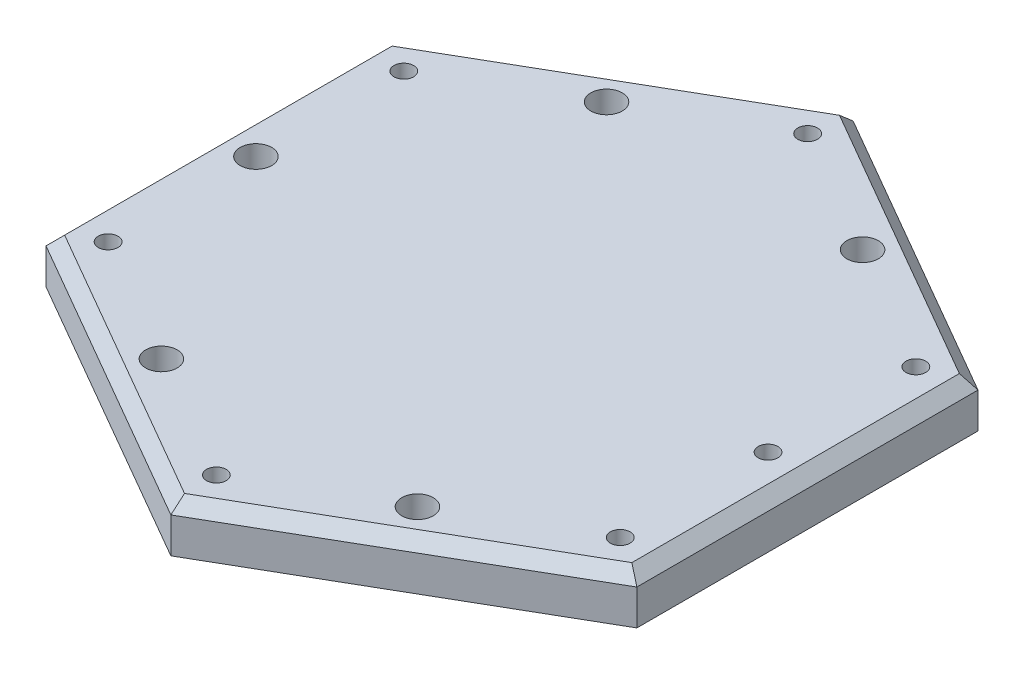
from build123d import *

# Parameters (mm, degrees)
EXTRUDE_2_DEPTH    = 12
CHAMFER_1_SIZE     = 3
HOLE_WIZARD_M6_2_D = 5
F_8_0MM_1_D        = 8


with BuildPart() as part:
    # 草圖2 → 填料-伸長2 (new body)
    with BuildSketch(Plane(origin=(0, 0, 0), x_dir=(1, 0, 0), z_dir=(0, 1, 0))):
        Polygon((0, 86.602540378), (-75, 43.301270189), (-75, -43.301270189), (0, -86.602540378), (75, -43.301270189), (75, 43.301270189), align=None)
    extrude(amount=EXTRUDE_2_DEPTH)

    # 導角1
    chamfer_1_edges = [part.edges().sort_by_distance(p)[0] for p in [
        (-75, 12, 0),
        (-37.5, 12, 64.951905284),
        (37.5, 12, 64.951905284),
        (75, 12, 0),
        (37.5, 12, -64.951905284),
        (-37.5, 12, -64.951905284),
    ]]
    chamfer(chamfer_1_edges, length=CHAMFER_1_SIZE)

    # M6 螺紋孔2 (through all)
    with Locations(Plane(origin=(-65, 12, 37.527767497), x_dir=(0, 0, 1), z_dir=(0, 1, 0))):
        with Locations((0, 0), (-75.055534994, 0), (-112.583302492, 65), (-75.055534994, 130), (-37.527767497, 130), (37.527767498, 65), (0, 130)):
            Hole(HOLE_WIZARD_M6_2_D / 2)

    # Ø8.0mm 定位孔1 (through all)
    with Locations(Plane(origin=(-65, 12, 0), x_dir=(0, 0, 1), z_dir=(0, 1, 0))):
        with Locations((0, 0), (56.5, 32.5), (56.5, 97.5), (-56.5, 97.5), (-56.5, 32.5)):
            Hole(F_8_0MM_1_D / 2)


solid = part.part
